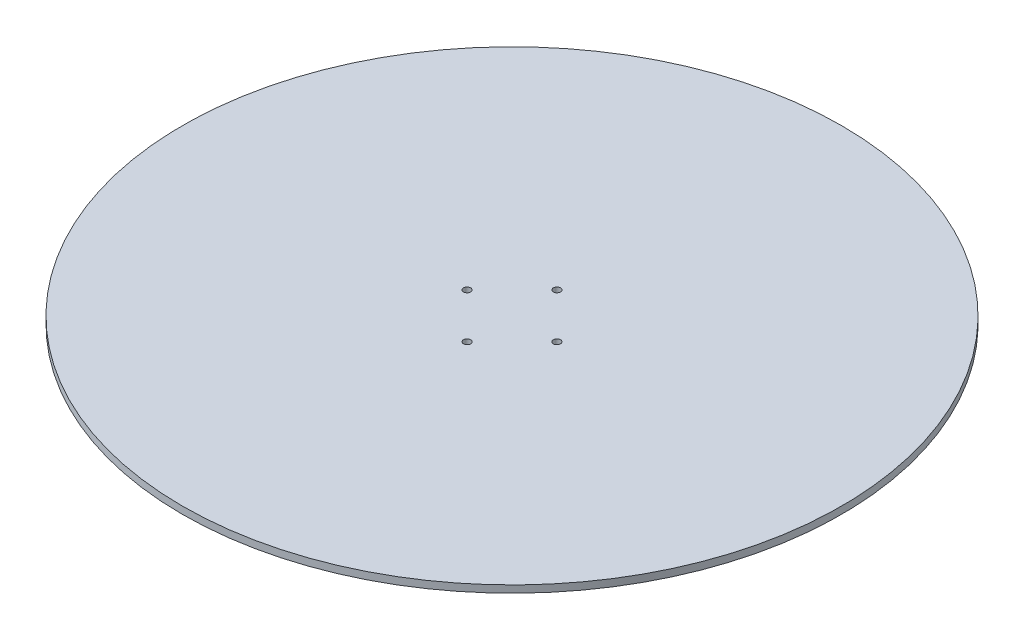
from build123d import *

# Parameters (mm, degrees)
ESBO_O1_R                  = 275
RESSALTO_EXTRUS_O1_DEPTH   = 6
FURO_DE_DI_METRO_6_0_6_1_D = 6


with BuildPart() as part:
    # Esboço1 → Ressalto-extrusão1 (new body)
    with BuildSketch(Plane(origin=(0, 0, 0), x_dir=(1, 0, 0), z_dir=(0, 1, 0))):
        with Locations(Location((0, 0, 0), (0, 0, 270))):
            Circle(ESBO_O1_R)
    extrude(amount=RESSALTO_EXTRUS_O1_DEPTH)

    # Furo de diâmetro Ø6.0 (6)1 (through all)
    with Locations(Plane(origin=(0, 6, 0), x_dir=(1, 0, 0), z_dir=(0, 1, 0))):
        with Locations((0, 37.5), (37.5, 0), (0, -37.5), (-37.5, 0)):
            Hole(FURO_DE_DI_METRO_6_0_6_1_D / 2)


solid = part.part
